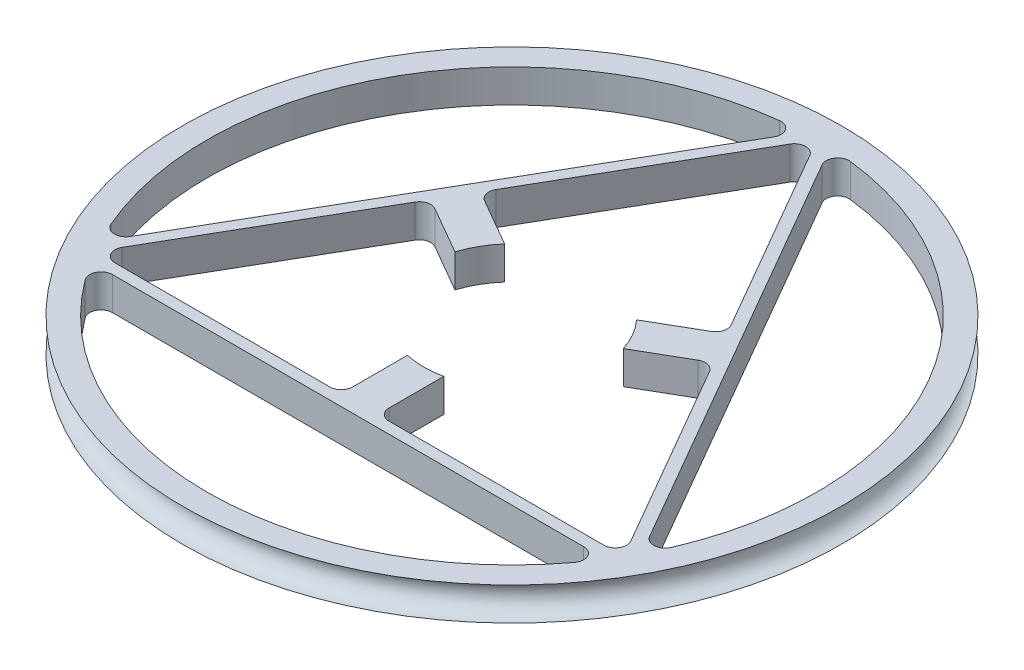
from build123d import *

# Parameters (mm, degrees)
SKETCH1_R           = 36.785134715
BOSS_EXTRUDE1_DEPTH = 3.683
SKETCH2_R           = 1.8415


with BuildPart() as part:
    # Sketch1 → Boss-Extrude1 (new body)
    with BuildSketch(Plane(origin=(0, 0, 0), x_dir=(1, 0, 0), z_dir=(0, 1, 0))):
        Circle(SKETCH1_R)
        with BuildLine():
            Line((-1.099852263, 32.146289174), (-13.115875302, 11.333926765))
            ThreePointArc((-13.115875302, 11.333926765), (-13.242748838, 10.370226578), (-12.651023039, 9.599074503))
            Line((-12.651023039, 9.599074503), (-7.368281269, 6.549082119))
            ThreePointArc((-7.368281269, 6.549082119), (-8.559992893, 4.889638753), (-9.384056343, 3.020187413))
            Line((-9.384056343, 3.020187413), (-14.683023039, 6.079547262))
            ThreePointArc((-14.683023039, 6.079547262), (-15.646723226, 6.206420798), (-16.417875302, 5.614694999))
            Line((-16.417875302, 5.614694999), (-28.389429193, -15.120644587))
            ThreePointArc((-28.389429193, -15.120644587), (-28.389429193, -16.390644587), (-27.289576931, -17.025644587))
            Line((-27.289576931, -17.025644587), (-3.302, -17.025644587))
            ThreePointArc((-3.302, -17.025644587), (-2.403974388, -16.653670199), (-2.032, -15.755644587))
            Line((-2.032, -15.755644587), (-2.032, -9.646399404))
            ThreePointArc((-2.032, -9.646399404), (0, -9.858095427), (2.032, -9.646399404))
            Line((2.032, -9.646399404), (2.032, -15.755644587))
            ThreePointArc((2.032, -15.755644587), (2.403974388, -16.653670199), (3.302, -17.025644587))
            Line((3.302, -17.025644587), (27.289576931, -17.025644587))
            ThreePointArc((27.289576931, -17.025644587), (28.389429193, -16.390644587), (28.389429193, -15.120644587))
            Line((28.389429193, -15.120644587), (16.395640728, 5.65320641))
            ThreePointArc((16.395640728, 5.65320641), (15.624488653, 6.24493221), (14.660788465, 6.118058673))
            Line((14.660788465, 6.118058673), (9.370026939, 3.063436081))
            ThreePointArc((9.370026939, 3.063436081), (8.537361073, 4.929047714), (7.338026939, 6.582963322))
            Line((7.338026939, 6.582963322), (12.628788465, 9.637585914))
            ThreePointArc((12.628788465, 9.637585914), (13.220514265, 10.408737989), (13.093640728, 11.372438177))
            Line((13.093640728, 11.372438177), (1.099852263, 32.146289174))
            ThreePointArc((1.099852263, 32.146289174), (0, 32.781289174), (-1.099852263, 32.146289174))
        make_face(mode=Mode.SUBTRACT)
        with BuildLine():
            Line((-2.693461931, 31.926076262), (-28.995524051, -13.630431675))
            ThreePointArc((-28.995524051, -13.630431675), (-30.168979582, -14.26329703), (-31.261319719, -13.498895652))
            ThreePointArc((-31.261319719, -13.498895652), (-29.489281456, 17.025644587), (-3.940273302, 33.822544859))
            ThreePointArc((-3.940273302, 33.822544859), (-2.732112221, 33.258751239), (-2.693461931, 31.926076262))
        make_face(mode=Mode.SUBTRACT)
        with BuildLine():
            Line((2.693461931, 31.926076262), (28.995524051, -13.630431675))
            ThreePointArc((28.995524051, -13.630431675), (30.168979582, -14.26329703), (31.261319719, -13.498895652))
            ThreePointArc((31.261319719, -13.498895652), (29.489281456, 17.025644587), (3.940273302, 33.822544859))
            ThreePointArc((3.940273302, 33.822544859), (2.732112221, 33.258751239), (2.693461931, 31.926076262))
        make_face(mode=Mode.SUBTRACT)
        with BuildLine():
            Line((-26.302062121, -18.295644587), (26.302062121, -18.295644587))
            ThreePointArc((26.302062121, -18.295644587), (27.436867361, -18.995454209), (27.321046417, -20.323649206))
            ThreePointArc((27.321046417, -20.323649206), (0, -34.051289174), (-27.321046417, -20.323649206))
            ThreePointArc((-27.321046417, -20.323649206), (-27.436867361, -18.995454209), (-26.302062121, -18.295644587))
        make_face(mode=Mode.SUBTRACT)
    extrude(amount=BOSS_EXTRUDE1_DEPTH)

    # Sketch2 → Cut-Revolve2 (revolve, cut)
    with BuildSketch(Plane.XY):
        with Locations((36.785134715, 1.8415)):
            Circle(SKETCH2_R)
    revolve(axis=Axis((0, 0, 0), (0, 1, 0)), mode=Mode.SUBTRACT)


solid = part.part
